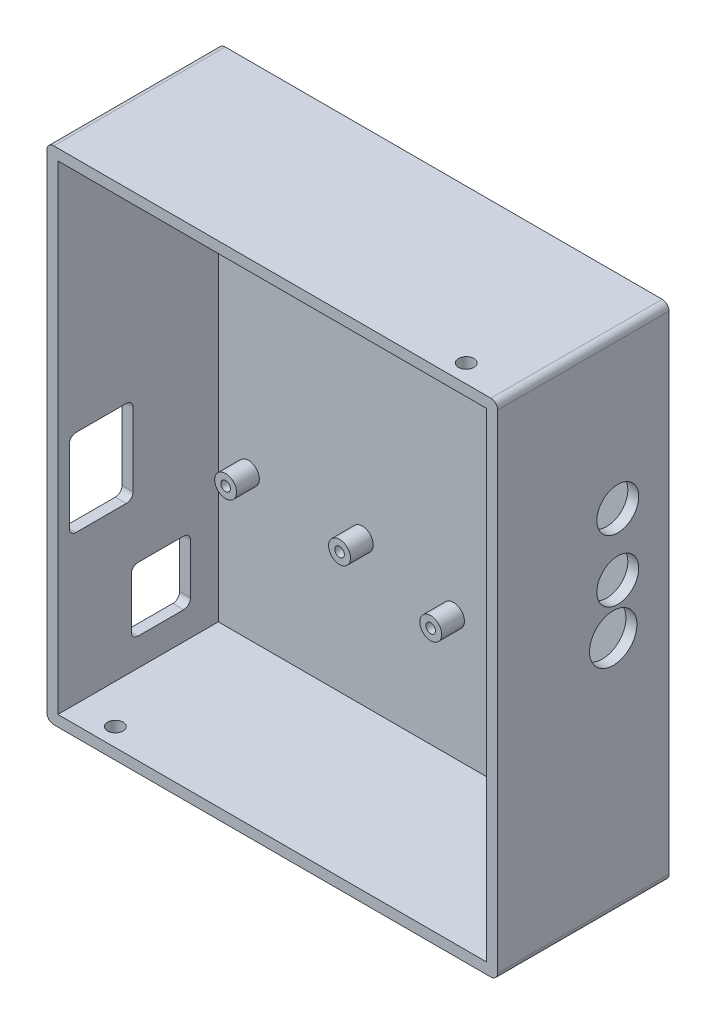
from build123d import *

# Parameters (mm, degrees)
FLOOR_2P4MM_DEPTH                         = 2.4
SIX_PCB_SUPPORTS_5MM_START                = 2.4
SKETCH_2_R                                = 2.4
SIX_PCB_SUPPORTS_5MM_DEPTH                = 5
INTEGRAL_FRONT_REAR_AND_SIDE_WALLS_START  = 2.4
SKETCH_3_W                                = 94.1
SKETCH_3_H                                = 105.2
INTEGRAL_FRONT_REAR_AND_SIDE_WALLS_DEPTH  = 35.2
SIX_BLIND_M2P5_STANDOFF_PILOTS_DEPTH      = 2.05
SIX_BLIND_M2P5_STANDOFF_PILOTS_DEPTH_BACK = 2.05
SIX_BLIND_M2P5_STANDOFF_PILOTS_START      = 5.35
SKETCH_4_R                                = 1.05
SIDE_LID_SCREW_1_DEPTH                    = 1.25
SIDE_LID_SCREW_1_DEPTH_BACK               = 1.25
SIDE_LID_SCREW_1_START                    = -8.3
SKETCH_5_R                                = 1.7
SIDE_LID_SCREW_2_DEPTH                    = 1.25
SIDE_LID_SCREW_2_DEPTH_BACK               = 1.25
SIDE_LID_SCREW_2_START                    = 99.3
SKETCH_6_R                                = 1.7
FRONT_AUDIO_ACCESS_DEPTH                  = 1.25
FRONT_AUDIO_ACCESS_DEPTH_BACK             = 1.25
FRONT_AUDIO_ACCESS_START                  = 93.7
SKETCH_7_R                                = 5.2
SKETCH_7_R_2                              = 4.6
REAR_DC_AND_USB_ACCESS_DEPTH              = 1.25
REAR_DC_AND_USB_ACCESS_DEPTH_BACK         = 1.25
REAR_DC_AND_USB_ACCESS_START              = -2.8


with BuildPart() as part:
    # 草图1 → Floor_2p4mm (new body)
    with BuildSketch(Plane.XY):
        with BuildLine():
            Line((-2.5, -9.5), (93.4, -9.5))
            ThreePointArc((93.4, -9.5), (94.460660172, -9.060660172), (94.9, -8))
            Line((94.9, -8), (94.9, 99))
            ThreePointArc((94.9, 99), (94.460660172, 100.060660172), (93.4, 100.5))
            Line((93.4, 100.5), (-2.5, 100.5))
            ThreePointArc((-2.5, 100.5), (-3.560660172, 100.060660172), (-4, 99))
            Line((-4, 99), (-4, -8))
            ThreePointArc((-4, -8), (-3.560660172, -9.060660172), (-2.5, -9.5))
        make_face()
    extrude(amount=FLOOR_2P4MM_DEPTH)

    # 草图2 → Six_PCB_supports_5mm (add)
    with BuildSketch(Plane.XY.offset(SIX_PCB_SUPPORTS_5MM_START)):
        with Locations((5, 24.5)):
            Circle(SKETCH_2_R)
        with Locations((5, 88)):
            Circle(SKETCH_2_R)
        with Locations((30, 24.5)):
            Circle(SKETCH_2_R)
        with Locations((30, 88)):
            Circle(SKETCH_2_R)
        with Locations((78, 12)):
            Circle(SKETCH_2_R)
        with Locations((50, 20)):
            Circle(SKETCH_2_R)
    extrude(amount=SIX_PCB_SUPPORTS_5MM_DEPTH)

    # 草图3 → Integral_front_rear_and_side_walls (add)
    with BuildSketch(Plane.XY.offset(INTEGRAL_FRONT_REAR_AND_SIDE_WALLS_START)):
        with BuildLine():
            Line((-2.5, -9.5), (93.4, -9.5))
            ThreePointArc((93.4, -9.5), (94.460660172, -9.060660172), (94.9, -8))
            Line((94.9, -8), (94.9, 99))
            ThreePointArc((94.9, 99), (94.460660172, 100.060660172), (93.4, 100.5))
            Line((93.4, 100.5), (-2.5, 100.5))
            ThreePointArc((-2.5, 100.5), (-3.560660172, 100.060660172), (-4, 99))
            Line((-4, 99), (-4, -8))
            ThreePointArc((-4, -8), (-3.560660172, -9.060660172), (-2.5, -9.5))
        make_face()
        with Locations((45.45, 45.5)):
            Rectangle(SKETCH_3_W, SKETCH_3_H, mode=Mode.SUBTRACT)
    extrude(amount=INTEGRAL_FRONT_REAR_AND_SIDE_WALLS_DEPTH)

    # 草图4 → Six_blind_M2p5_standoff_pilots (cut, two sides: drawn at the far end of the back side and taken through both)
    with BuildSketch(Plane.XY.offset(SIX_BLIND_M2P5_STANDOFF_PILOTS_START - SIX_BLIND_M2P5_STANDOFF_PILOTS_DEPTH_BACK)):
        with Locations((5, 24.5)):
            Circle(SKETCH_4_R)
        with Locations((5, 88)):
            Circle(SKETCH_4_R)
        with Locations((30, 24.5)):
            Circle(SKETCH_4_R)
        with Locations((30, 88)):
            Circle(SKETCH_4_R)
        with Locations((78, 12)):
            Circle(SKETCH_4_R)
        with Locations((50, 20)):
            Circle(SKETCH_4_R)
    extrude(amount=SIX_BLIND_M2P5_STANDOFF_PILOTS_DEPTH + SIX_BLIND_M2P5_STANDOFF_PILOTS_DEPTH_BACK, mode=Mode.SUBTRACT)

    # 草图5 → Side_lid_screw_1 (cut, two sides: drawn at the far end of the back side and taken through both)
    with BuildSketch(Plane(origin=(0, 0, 0), x_dir=(1, 0, 0), z_dir=(0, 1, 0)).offset(SIDE_LID_SCREW_1_START - SIDE_LID_SCREW_1_DEPTH_BACK)):
        with Locations(Location((7, -33.6, 0), (0, 0, 270))):
            Circle(SKETCH_5_R)
    extrude(amount=SIDE_LID_SCREW_1_DEPTH + SIDE_LID_SCREW_1_DEPTH_BACK, mode=Mode.SUBTRACT)

    # 草图6 → Side_lid_screw_2 (cut, two sides: drawn at the far end of the back side and taken through both)
    with BuildSketch(Plane(origin=(0, 0, 0), x_dir=(1, 0, 0), z_dir=(0, 1, 0)).offset(SIDE_LID_SCREW_2_START - SIDE_LID_SCREW_2_DEPTH_BACK)):
        with Locations(Location((84, -33.6, 0), (0, 0, 90))):
            Circle(SKETCH_6_R)
    extrude(amount=SIDE_LID_SCREW_2_DEPTH + SIDE_LID_SCREW_2_DEPTH_BACK, mode=Mode.SUBTRACT)

    # 草图7 → Front_audio_access (cut, two sides: drawn at the far end of the back side and taken through both)
    with BuildSketch(Plane(origin=(0, 0, 0), x_dir=(0, 0, -1), z_dir=(1, 0, 0)).offset(FRONT_AUDIO_ACCESS_START - FRONT_AUDIO_ACCESS_DEPTH_BACK)):
        with Locations(Location((-12.25, 43.0009, 0), (0, 0, 180))):
            Circle(SKETCH_7_R)
        with Locations(Location((-11.25, 53.5, 0), (0, 0, 180))):
            Circle(SKETCH_7_R_2)
        with Locations(Location((-11.25, 67.1, 0), (0, 0, 180))):
            Circle(SKETCH_7_R_2)
    extrude(amount=FRONT_AUDIO_ACCESS_DEPTH + FRONT_AUDIO_ACCESS_DEPTH_BACK, mode=Mode.SUBTRACT)

    # 草图8 → Rear_DC_and_USB_access (cut, two sides: drawn at the far end of the back side and taken through both)
    with BuildSketch(Plane(origin=(0, 0, 0), x_dir=(0, 0, -1), z_dir=(1, 0, 0)).offset(REAR_DC_AND_USB_ACCESS_START - REAR_DC_AND_USB_ACCESS_DEPTH_BACK)):
        with BuildLine():
            Line((-8.5, 0.5), (-8.5, 11.5))
            ThreePointArc((-8.5, 11.5), (-8.939339828, 12.560660172), (-10, 13))
            Line((-10, 13), (-20, 13))
            ThreePointArc((-20, 13), (-21.060660172, 12.560660172), (-21.5, 11.5))
            Line((-21.5, 11.5), (-21.5, 0.5))
            ThreePointArc((-21.5, 0.5), (-21.060660172, -0.560660172), (-20, -1))
            Line((-20, -1), (-10, -1))
            ThreePointArc((-10, -1), (-8.939339828, -0.560660172), (-8.5, 0.5))
        make_face()
        with BuildLine():
            Line((-21.1, 27), (-21.1, 43))
            ThreePointArc((-21.1, 43), (-21.539339828, 44.060660172), (-22.6, 44.5))
            Line((-22.6, 44.5), (-33.6, 44.5))
            ThreePointArc((-33.6, 44.5), (-34.660660172, 44.060660172), (-35.1, 43))
            Line((-35.1, 43), (-35.1, 27))
            ThreePointArc((-35.1, 27), (-34.660660172, 25.939339828), (-33.6, 25.5))
            Line((-33.6, 25.5), (-22.6, 25.5))
            ThreePointArc((-22.6, 25.5), (-21.539339828, 25.939339828), (-21.1, 27))
        make_face()
    extrude(amount=REAR_DC_AND_USB_ACCESS_DEPTH + REAR_DC_AND_USB_ACCESS_DEPTH_BACK, mode=Mode.SUBTRACT)


solid = part.part
